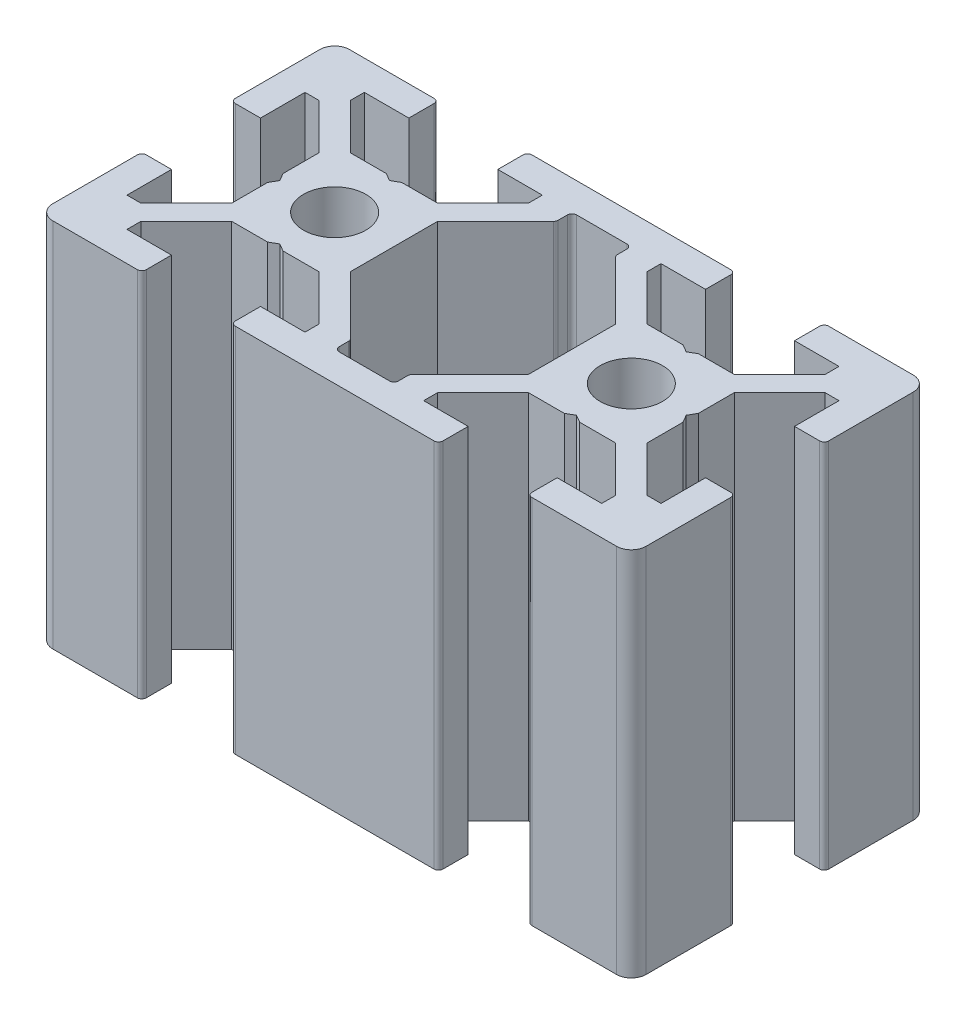
from build123d import *

# Parameters (mm, degrees)
MODEL_R                  = 2.0999999
STRUCTURAL_MEMBER1_DEPTH = 25


with BuildPart() as part:
    # Model → Structural Member1 (new body)
    with BuildSketch(Plane.ZX):
        with BuildLine():
            Line((-10, -13.3000005), (-10, -19))
            ThreePointArc((-10, -19), (-9.707106781, -19.707106781), (-9, -20))
            Line((-9, -20), (-3.3, -20))
            ThreePointArc((-3.3, -20), (-3.087867966, -19.912132034), (-3, -19.7))
            Line((-3, -19.7), (-3, -18))
            Line((-3, -18), (-6, -18))
            Line((-6, -18), (-6, -17.0606825))
            Line((-6, -17.0606825), (-2.939318, -14))
            Line((-2.939318, -14), (-0.519615242, -14))
            Line((-0.519615242, -14), (0, -13.7))
            Line((0, -13.7), (0.519615242, -14))
            Line((0.519615242, -14), (2.9393365, -14))
            Line((2.9393365, -14), (6, -17.0606628))
            Line((6, -17.0606628), (6, -18))
            Line((6, -18), (3, -18))
            Line((3, -18), (3, -19.7))
            ThreePointArc((3, -19.7), (3.087867966, -19.912132034), (3.3, -20))
            Line((3.3, -20), (9, -20))
            ThreePointArc((9, -20), (9.707106781, -19.707106781), (10, -19))
            Line((10, -19), (10, -13.3000005))
            ThreePointArc((10, -13.3000005), (9.912132034, -13.087868466), (9.7, -13.0000005))
            Line((9.7, -13.0000005), (8, -13.0000005))
            Line((8, -13.0000005), (8, -16.0000005))
            Line((8, -16.0000005), (7.06065685, -16.0000005))
            Line((7.06065685, -16.0000005), (4, -12.93934215))
            Line((4, -12.93934215), (4, -10.519615742))
            Line((4, -10.519615742), (3.7, -10.0000005))
            Line((3.7, -10.0000005), (4, -9.480385258))
            Line((4, -9.480385258), (4, -7.06068365))
            Line((4, -7.06068365), (7.06068236, -4.000000504))
            Line((7.06068236, -4.000000504), (8, -4.000000504))
            Line((8, -4.000000504), (8, -7.0000005))
            Line((8, -7.0000005), (9.7, -7.0000005))
            ThreePointArc((9.7, -7.0000005), (9.912132034, -6.912132534), (10, -6.7000005))
            Line((10, -6.7000005), (10, 6.7))
            ThreePointArc((10, 6.7), (9.912132034, 6.912132034), (9.7, 7))
            Line((9.7, 7), (8, 7))
            Line((8, 7), (8, 4))
            Line((8, 4), (7.060678, 4))
            Line((7.060678, 4), (4, 7.06068075))
            Line((4, 7.06068075), (4, 9.480384758))
            Line((4, 9.480384758), (3.7, 10))
            Line((3.7, 10), (4, 10.519615242))
            Line((4, 10.519615242), (4, 12.93933675))
            Line((4, 12.93933675), (7.060661, 16))
            Line((7.060661, 16), (8, 16))
            Line((8, 16), (8, 13))
            Line((8, 13), (9.7, 13))
            ThreePointArc((9.7, 13), (9.912132034, 13.087867966), (10, 13.3))
            Line((10, 13.3), (10, 19))
            ThreePointArc((10, 19), (9.707106781, 19.707106781), (9, 20))
            Line((9, 20), (3.3, 20))
            ThreePointArc((3.3, 20), (3.087867966, 19.912132034), (3, 19.7))
            Line((3, 19.7), (3, 18))
            Line((3, 18), (6, 18))
            Line((6, 18), (6, 17.06065975))
            Line((6, 17.06065975), (2.939354, 14))
            Line((2.939354, 14), (0.519638625, 14))
            Line((0.519638625, 14), (0, 13.6999865))
            Line((0, 13.6999865), (-0.519638625, 14))
            Line((-0.519638625, 14), (-2.939335, 14))
            Line((-2.939335, 14), (-6, 17.060678))
            Line((-6, 17.060678), (-6, 18))
            Line((-6, 18), (-3, 18))
            Line((-3, 18), (-3, 19.7))
            ThreePointArc((-3, 19.7), (-3.087867966, 19.912132034), (-3.3, 20))
            Line((-3.3, 20), (-9, 20))
            ThreePointArc((-9, 20), (-9.707106781, 19.707106781), (-10, 19))
            Line((-10, 19), (-10, 13.3))
            ThreePointArc((-10, 13.3), (-9.912132034, 13.087867966), (-9.7, 13))
            Line((-9.7, 13), (-8, 13))
            Line((-8, 13), (-8, 16))
            Line((-8, 16), (-7.060642, 16))
            Line((-7.060642, 16), (-4, 12.9393565))
            Line((-4, 12.9393565), (-4, 10.519615242))
            Line((-4, 10.519615242), (-3.7, 10))
            Line((-3.7, 10), (-4, 9.480384758))
            Line((-4, 9.480384758), (-4, 7.06066))
            Line((-4, 7.06066), (-7.060659, 4))
            Line((-7.060659, 4), (-8, 4))
            Line((-8, 4), (-8, 7))
            Line((-8, 7), (-9.7, 7))
            ThreePointArc((-9.7, 7), (-9.912132034, 6.912132034), (-10, 6.7))
            Line((-10, 6.7), (-10, -6.7000005))
            ThreePointArc((-10, -6.7000005), (-9.912132034, -6.912132534), (-9.7, -7.0000005))
            Line((-9.7, -7.0000005), (-8, -7.0000005))
            Line((-8, -7.0000005), (-8, -4.0000005))
            Line((-8, -4.0000005), (-7.06066257, -4.0000005))
            Line((-7.06066257, -4.0000005), (-4, -7.0606688))
            Line((-4, -7.0606688), (-4, -9.480385258))
            Line((-4, -9.480385258), (-3.7, -10.0000005))
            Line((-3.7, -10.0000005), (-4, -10.519615742))
            Line((-4, -10.519615742), (-4, -12.9393575))
            Line((-4, -12.9393575), (-7.0606365, -16.0000005))
            Line((-7.0606365, -16.0000005), (-8, -16.0000005))
            Line((-8, -16.0000005), (-8, -13.0000005))
            Line((-8, -13.0000005), (-9.7, -13.0000005))
            ThreePointArc((-9.7, -13.0000005), (-9.912132034, -13.087868466), (-10, -13.3000005))
        make_face()
        with Locations((0, 10)):
            Circle(MODEL_R, mode=Mode.SUBTRACT)
        with Locations((0, -10.0000005)):
            Circle(MODEL_R, mode=Mode.SUBTRACT)
        with BuildLine():
            Line((-8, 1.6999995), (-8, -1.70000025))
            ThreePointArc((-8, -1.70000025), (-7.912132034, -1.912132284), (-7.7, -2.00000025))
            Line((-7.7, -2.00000025), (-7.063604538, -2.00000025))
            ThreePointArc((-7.063604538, -2.00000025), (-6.948800316, -2.022823986), (-6.851481305, -2.087861995))
            Line((-6.851481305, -2.087861995), (-2.939335, -6))
            Line((-2.939335, -6), (2.93933195, -6))
            Line((2.93933195, -6), (6.851479294, -2.087861656))
            ThreePointArc((6.851479294, -2.087861656), (6.948799922, -2.022824212), (7.06360515, -2.00000025))
            Line((7.06360515, -2.00000025), (7.7, -2.00000025))
            ThreePointArc((7.7, -2.00000025), (7.912132034, -1.912132284), (8, -1.70000025))
            Line((8, -1.70000025), (8, 1.6999995))
            ThreePointArc((8, 1.6999995), (7.912132034, 1.912131534), (7.7, 1.9999995))
            Line((7.7, 1.9999995), (7.06359945, 1.9999995))
            ThreePointArc((7.06359945, 1.9999995), (6.9487942, 2.022823721), (6.851474147, 2.087862153))
            Line((6.851474147, 2.087862153), (2.9393355, 6))
            Line((2.9393355, 6), (-2.939339, 6))
            Line((-2.939339, 6), (-6.851476944, 2.087862556))
            ThreePointArc((-6.851476944, 2.087862556), (-6.948795311, 2.022823488), (-7.063599538, 1.9999995))
            Line((-7.063599538, 1.9999995), (-7.7, 1.9999995))
            ThreePointArc((-7.7, 1.9999995), (-7.912132034, 1.912131534), (-8, 1.6999995))
        make_face(mode=Mode.SUBTRACT)
    extrude(amount=STRUCTURAL_MEMBER1_DEPTH)


solid = part.part
